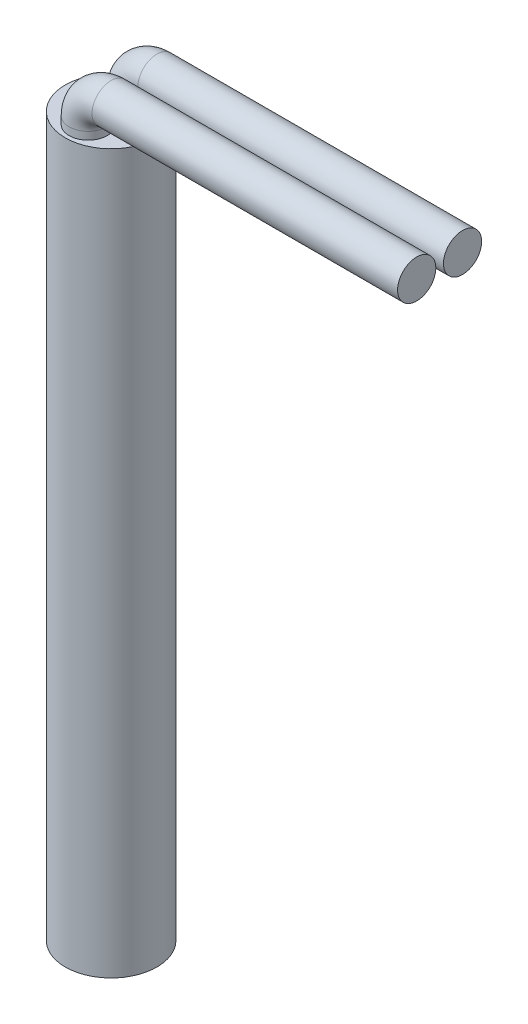
from build123d import *

# Parameters (mm, degrees)
SKETCH1_R           = 3
BOSS_EXTRUDE1_DEPTH = 47
SKETCH3_R           = 1.25


with BuildPart() as part:
    # Sketch1 → Boss-Extrude1 (new body)
    with BuildSketch(Plane(origin=(0, 0, 0), x_dir=(1, 0, 0), z_dir=(0, 1, 0))):
        with Locations(Location((0, 0, 0), (0, 0, 270))):
            Circle(SKETCH1_R)
    extrude(amount=BOSS_EXTRUDE1_DEPTH)

    # Sweep1: sweep along a path in Sketch2
    with BuildLine(Plane.XY.offset(1.5)) as sweep1_path:
        Line((0, 47), (0, 47.5))
        ThreePointArc((0, 47.5), (0.439339828, 48.560660172), (1.5, 49))
        Line((1.5, 49), (21.5, 49))
    # Sketch3 → Sweep1 (sweep)
    with BuildSketch(Plane(origin=(0, 47, 0), x_dir=(1, 0, 0), z_dir=(0, 1, 0))):
        with Locations((0, -1.5)):
            Circle(SKETCH3_R)
    sweep1 = sweep(path=sweep1_path.line)

    # Mirror1: Sweep1 across plane
    add(sweep1.mirror(Plane.XY))


solid = part.part
